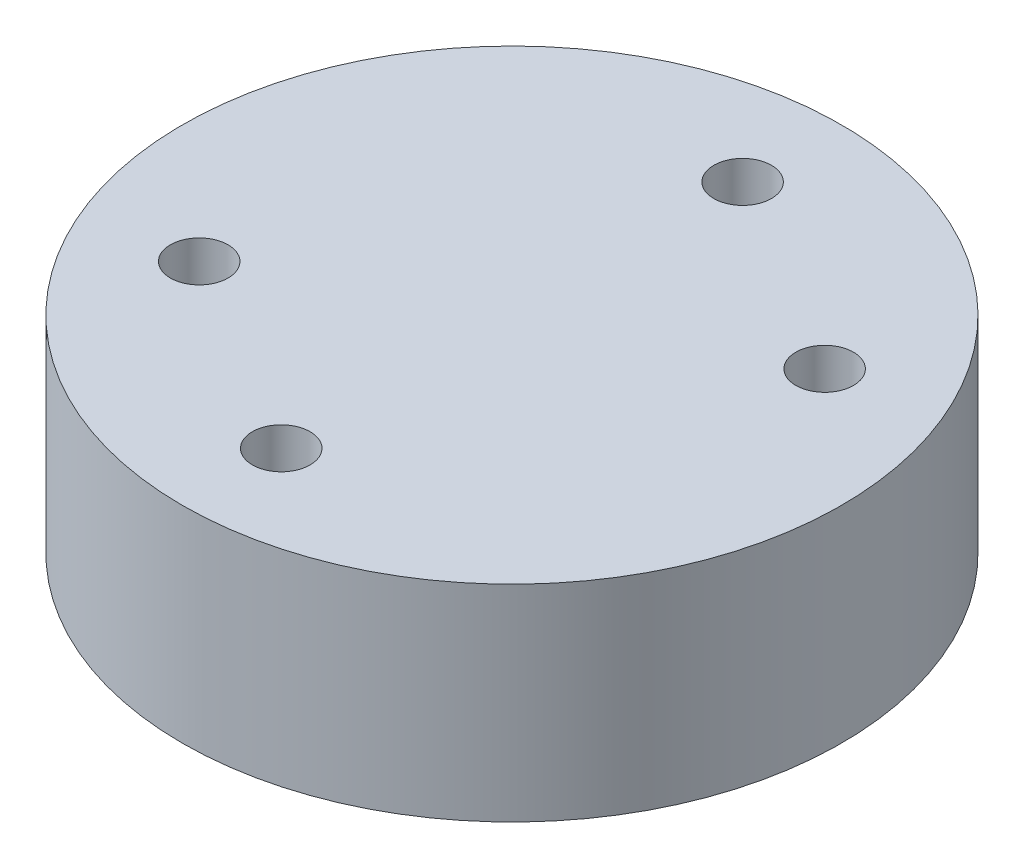
from build123d import *

# Parameters (mm, degrees)
SKETCH1_R           = 10.16
BOSS_EXTRUDE1_DEPTH = 6.35
SKETCH2_R           = 0.889
CUT_EXTRUDE3_DEPTH  = 7.62


with BuildPart() as part:
    # Sketch1 → Boss-Extrude1 (new body)
    with BuildSketch(Plane(origin=(0, 0, 0), x_dir=(1, 0, 0), z_dir=(0, 1, 0))):
        with Locations(Location((0, 0, 0), (0, 0, 270))):
            Circle(SKETCH1_R)
    extrude(amount=BOSS_EXTRUDE1_DEPTH)

    # Sketch2 → Cut-Extrude3 (cut)
    with BuildSketch(Plane(origin=(0, 6.35, 0), x_dir=(1, 0, 0), z_dir=(0, 1, 0))):
        with Locations(Location((0, -7.112, 0), (0, 0, 270))):
            Circle(SKETCH2_R)
        with Locations(Location((0, 7.112, 0), (0, 0, 270))):
            Circle(SKETCH2_R)
        with Locations(Location((-6.253873085, -3.38668207, 0), (0, 0, 270))):
            Circle(SKETCH2_R)
        with Locations(Location((6.253873085, 3.38668207, 0), (0, 0, 270))):
            Circle(SKETCH2_R)
    extrude(amount=-CUT_EXTRUDE3_DEPTH, mode=Mode.SUBTRACT)


solid = part.part
